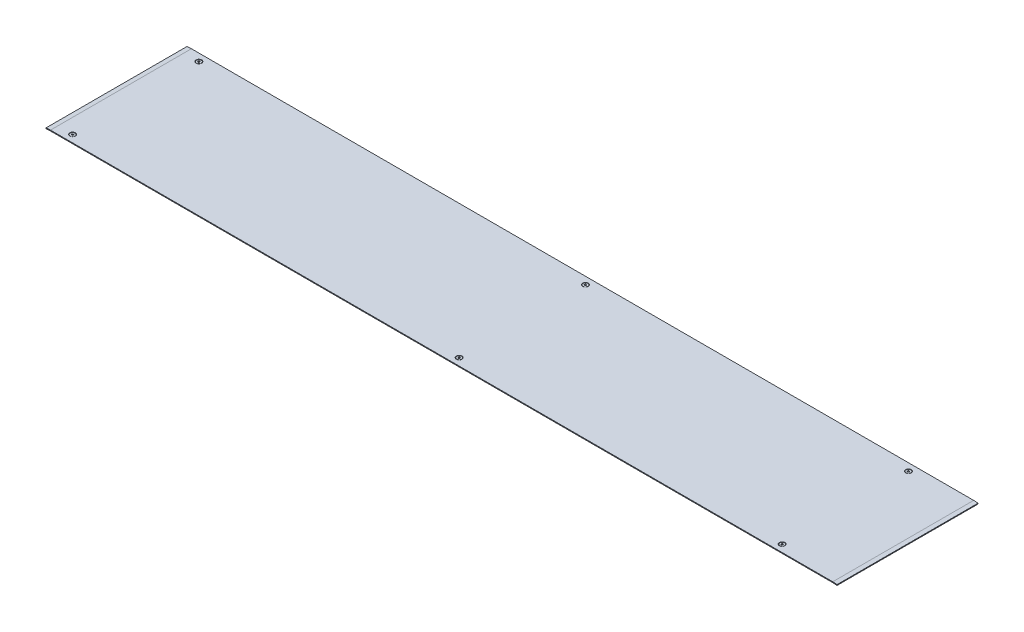
from build123d import *

# Parameters (mm, degrees)
BOSS_EXTRUDE1_DEPTH    = 86.5
CUT_EXTRUDE1_DEPTH     = 1.2
BOSS_EXTRUDE2_DEPTH    = 2.4
LPATTERN1_COUNT        = 2
LPATTERN1_PITCH        = 871
LPATTERN1_COPY_3_DEPTH = 1.2
LPATTERN1_COPY_4_DEPTH = 2.4
LPATTERN2_COUNT        = 2
LPATTERN2_PITCH        = 474.5
LPATTERN2_COPY_3_DEPTH = 1.2
LPATTERN2_COPY_4_DEPTH = 2.4


with BuildPart() as part:
    # Sketch1 → Boss-Extrude1 (new, symmetric)
    with BuildSketch(Plane.XY):
        Polygon((15.3, 14.615402534), (15.369756474, 13.617838484), (20.834920769, 14), (981.005079231, 14), (986.270243526, 13.631823846), (986.34, 14.629387897), (981.04, 15), (20.8, 15), align=None)
    extrude(amount=BOSS_EXTRUDE1_DEPTH, both=True)

    # Sketch3 → Cut-Revolve1 (revolve, cut)
    with BuildSketch(Plane.XY.offset(77.5)):
        Polygon((39, 15), (42.5, 15), (41.5, 14), (39, 14), align=None)
    cut_revolve1 = revolve(axis=Axis((39, 14, 77.5), (0, 1, 0)), mode=Mode.SUBTRACT)

    # Sketch4 → Revolve1 (revolve)
    with BuildSketch(Plane.XY.offset(77.5)):
        Polygon((39, 14.8), (42, 14.8), (42, 14.5), (40.5, 13), (40.5, 9.3), (39, 9.3), align=None)
    revolve1 = revolve(axis=Axis((39, 15, 77.5), (0, -1, 0)))

    # Sketch5 → Cut-Extrude1 (cut)
    with BuildSketch(Plane(origin=(0, 14.8, 0), x_dir=(1, 0, 0), z_dir=(0, 1, 0))):
        Polygon((39, -76.345299462), (38, -76.922649731), (38, -78.077350269), (39, -78.654700538), (40, -78.077350269), (40, -76.922649731), align=None)
    cut_extrude1 = extrude(amount=-CUT_EXTRUDE1_DEPTH, mode=Mode.SUBTRACT)

    # Sketch6 → Boss-Extrude2 (add)
    with BuildSketch(Plane(origin=(0, 11.4, 0), x_dir=(1, 0, 0), z_dir=(0, 1, 0))):
        Polygon((35.824573519, -77.5), (37.41228676, -80.25), (40.58771324, -80.25), (42.175426481, -77.5), (40.58771324, -74.75), (37.41228676, -74.75), align=None)
    boss_extrude2 = extrude(amount=-BOSS_EXTRUDE2_DEPTH)

    # Mirror1: Cut-Revolve1, Revolve1, Cut-Extrude1, Boss-Extrude2 across plane
    add(cut_revolve1.mirror(Plane.XY), mode=Mode.SUBTRACT)
    add(revolve1.mirror(Plane.XY))
    add(cut_extrude1.mirror(Plane.XY), mode=Mode.SUBTRACT)
    add(boss_extrude2.mirror(Plane.XY))

    # LPattern1: Cut-Revolve1, Revolve1, Cut-Extrude1, Boss-Extrude2 ×2
    with Locations(*[(i * LPATTERN1_PITCH, 0, 0) for i in range(1, LPATTERN1_COUNT)]):
        add(cut_revolve1, mode=Mode.SUBTRACT)
        add(revolve1)
        add(cut_extrude1, mode=Mode.SUBTRACT)
        add(boss_extrude2)

    # LPattern1 copy 1 sketch → LPattern1 copy 1 (revolve, cut)
    with BuildSketch(Plane(origin=(871, 0, -77.5), x_dir=(1, 0, 0), z_dir=(0, 0, -1))):
        Polygon((39, -15), (42.5, -15), (41.5, -14), (39, -14), align=None)
    revolve(axis=Axis((910, 14, -77.5), (0, -1, 0)), mode=Mode.SUBTRACT)

    # LPattern1 copy 2 sketch → LPattern1 copy 2 (revolve)
    with BuildSketch(Plane(origin=(871, 0, -77.5), x_dir=(1, 0, 0), z_dir=(0, 0, -1))):
        Polygon((39, -14.8), (42, -14.8), (42, -14.5), (40.5, -13), (40.5, -9.3), (39, -9.3), align=None)
    revolve(axis=Axis((910, 15, -77.5), (0, 1, 0)))

    # LPattern1 copy 3 sketch → LPattern1 copy 3 (cut)
    with BuildSketch(Plane(origin=(871, 14.8, 0), x_dir=(1, 0, 0), z_dir=(0, 1, 0))):
        Polygon((39, 76.345299462), (38, 76.922649731), (38, 78.077350269), (39, 78.654700538), (40, 78.077350269), (40, 76.922649731), align=None)
    extrude(amount=-LPATTERN1_COPY_3_DEPTH, mode=Mode.SUBTRACT)

    # LPattern1 copy 4 sketch → LPattern1 copy 4 (add)
    with BuildSketch(Plane(origin=(871, 11.4, 0), x_dir=(1, 0, 0), z_dir=(0, 1, 0))):
        Polygon((35.824573519, 77.5), (37.41228676, 80.25), (40.58771324, 80.25), (42.175426481, 77.5), (40.58771324, 74.75), (37.41228676, 74.75), align=None)
    extrude(amount=-LPATTERN1_COPY_4_DEPTH)

    # LPattern2: Cut-Revolve1, Revolve1, Cut-Extrude1, Boss-Extrude2 ×2
    with Locations(*[(i * LPATTERN2_PITCH, 0, 0) for i in range(1, LPATTERN2_COUNT)]):
        add(cut_revolve1, mode=Mode.SUBTRACT)
        add(revolve1)
        add(cut_extrude1, mode=Mode.SUBTRACT)
        add(boss_extrude2)

    # LPattern2 copy 1 sketch → LPattern2 copy 1 (revolve, cut)
    with BuildSketch(Plane(origin=(474.5, 0, -77.5), x_dir=(1, 0, 0), z_dir=(0, 0, -1))):
        Polygon((39, -15), (42.5, -15), (41.5, -14), (39, -14), align=None)
    revolve(axis=Axis((513.5, 14, -77.5), (0, -1, 0)), mode=Mode.SUBTRACT)

    # LPattern2 copy 2 sketch → LPattern2 copy 2 (revolve)
    with BuildSketch(Plane(origin=(474.5, 0, -77.5), x_dir=(1, 0, 0), z_dir=(0, 0, -1))):
        Polygon((39, -14.8), (42, -14.8), (42, -14.5), (40.5, -13), (40.5, -9.3), (39, -9.3), align=None)
    revolve(axis=Axis((513.5, 15, -77.5), (0, 1, 0)))

    # LPattern2 copy 3 sketch → LPattern2 copy 3 (cut)
    with BuildSketch(Plane(origin=(474.5, 14.8, 0), x_dir=(1, 0, 0), z_dir=(0, 1, 0))):
        Polygon((39, 76.345299462), (38, 76.922649731), (38, 78.077350269), (39, 78.654700538), (40, 78.077350269), (40, 76.922649731), align=None)
    extrude(amount=-LPATTERN2_COPY_3_DEPTH, mode=Mode.SUBTRACT)

    # LPattern2 copy 4 sketch → LPattern2 copy 4 (add)
    with BuildSketch(Plane(origin=(474.5, 11.4, 0), x_dir=(1, 0, 0), z_dir=(0, 1, 0))):
        Polygon((35.824573519, 77.5), (37.41228676, 80.25), (40.58771324, 80.25), (42.175426481, 77.5), (40.58771324, 74.75), (37.41228676, 74.75), align=None)
    extrude(amount=-LPATTERN2_COPY_4_DEPTH)


solid = part.part
